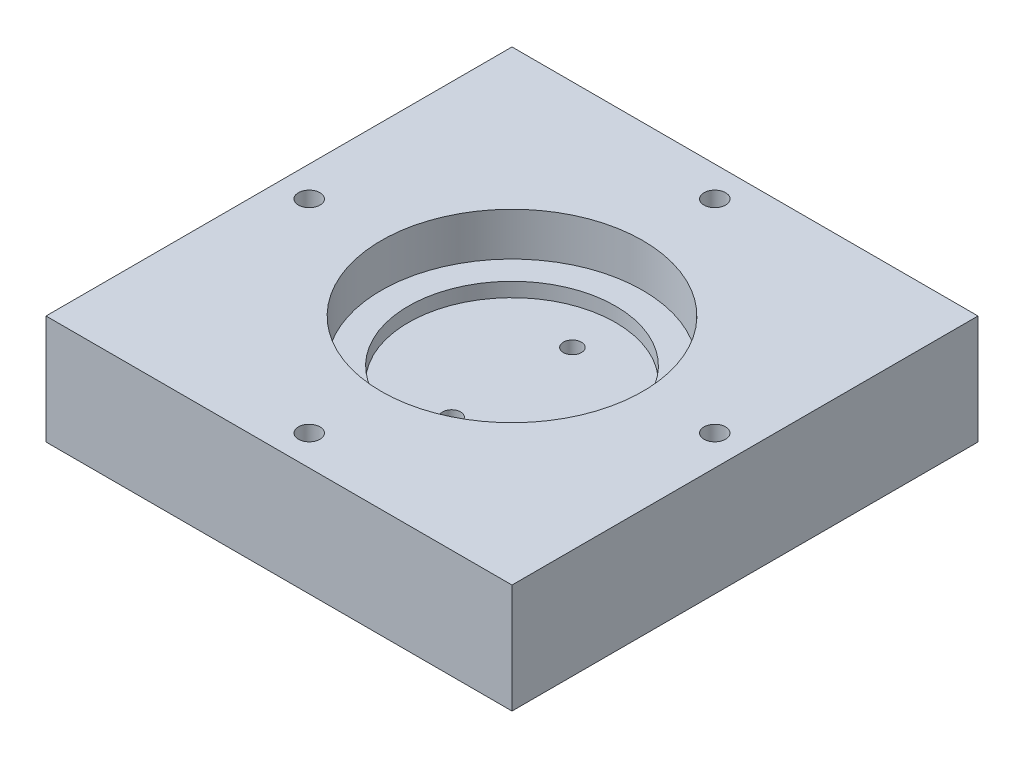
from build123d import *

# Parameters (mm, degrees)
SKETCH1_R                       = 27
SKETCH1_R_2                     = 1.05
BOSS_EXTRUDE1_DEPTH             = 3
SKETCH2_R                       = 27
SKETCH2_R_2                     = 12
BOSS_EXTRUDE2_DEPTH             = 1.65
SKETCH3_R                       = 27
SKETCH3_R_2                     = 15.15
BOSS_EXTRUDE3_DEPTH             = 5
BOSS_EXTRUDE4_START             = 3
SKETCH4_R                       = 27
SKETCH4_R_2                     = 1.875
BOSS_EXTRUDE4_DEPTH             = 3
SKETCH6_R                       = 1.25
CUT_EXTRUDE2_DEPTH              = 41.224650402
CIRPATTERN2_COUNT               = 4
BOSS_EXTRUDE5_REACH             = 41.384
BOSS_EXTRUDE5_DIRECTION_2_REACH = 41.384


with BuildPart() as part:
    # Sketch1 → Boss-Extrude1 (new body)
    with BuildSketch(Plane(origin=(0, 0, 0), x_dir=(1, 0, 0), z_dir=(0, 1, 0))):
        with Locations(Location((0, 0, 0), (0, 0, 270))):
            Circle(SKETCH1_R)
        with Locations(Location((0, 7, 0), (0, 0, 270))):
            Circle(SKETCH1_R_2, mode=Mode.SUBTRACT)
        with Locations(Location((0, -7, 0), (0, 0, 270))):
            Circle(SKETCH1_R_2, mode=Mode.SUBTRACT)
    extrude(amount=BOSS_EXTRUDE1_DEPTH)

    # Sketch2 → Boss-Extrude2 (add)
    with BuildSketch(Plane(origin=(0, 3, 0), x_dir=(1, 0, 0), z_dir=(0, 1, 0))):
        with Locations(Location((0, 0, 0), (0, 0, 270))):
            Circle(SKETCH2_R)
        with Locations(Location((0, 0, 0), (0, 0, 270))):
            Circle(SKETCH2_R_2, mode=Mode.SUBTRACT)
    extrude(amount=BOSS_EXTRUDE2_DEPTH)

    # Sketch3 → Boss-Extrude3 (add)
    with BuildSketch(Plane(origin=(0, 4.65, 0), x_dir=(1, 0, 0), z_dir=(0, 1, 0))):
        with Locations(Location((0, 0, 0), (0, 0, 270))):
            Circle(SKETCH3_R)
        with Locations(Location((0, 0, 0), (0, 0, 270))):
            Circle(SKETCH3_R_2, mode=Mode.SUBTRACT)
    extrude(amount=BOSS_EXTRUDE3_DEPTH)

    # Sketch4 → Boss-Extrude4 (add)
    with BuildSketch(Plane.XZ.offset(BOSS_EXTRUDE4_START)):
        with Locations(Location((0, 0, 0), (0, 0, 270))):
            Circle(SKETCH4_R)
        with Locations(Location((0, -7, 0), (0, 0, 270))):
            Circle(SKETCH4_R_2, mode=Mode.SUBTRACT)
        with Locations(Location((0, 7, 0), (0, 0, 270))):
            Circle(SKETCH4_R_2, mode=Mode.SUBTRACT)
    extrude(amount=-BOSS_EXTRUDE4_DEPTH)

    # Sketch6 → Cut-Extrude2 (cut, through all)
    with BuildSketch(Plane(origin=(0, 9.65, 0), x_dir=(1, 0, 0), z_dir=(0, 1, 0))):
        with Locations(Location((0, 23.5, 0), (0, 0, 270))):
            Circle(SKETCH6_R)
    cut_extrude2 = extrude(amount=-CUT_EXTRUDE2_DEPTH, mode=Mode.SUBTRACT)

    # CirPattern2: Cut-Extrude2 ×4 about axis
    cirpattern2_axis = Axis((0, 0, 0), (0, 1, 0))
    for i in range(1, CIRPATTERN2_COUNT):
        add(cut_extrude2.rotate(cirpattern2_axis, i * 360 / CIRPATTERN2_COUNT), mode=Mode.SUBTRACT)

    # Boss-Extrude5: up to this face of the body (flat: up to its plane)
    boss_extrude5_end = Plane(part.part.faces().sort_by_distance((0, 9.65, -26.236324676))[0])
    # Sketch7 → Boss-Extrude5 (add, up to the picked face)
    with BuildSketch(Plane(origin=(0, 0, 0), x_dir=(1, 0, 0), z_dir=(0, 1, 0)), mode=Mode.PRIVATE) as boss_extrude5_sk1:
        with BuildLine():
            Line((0, 27), (-27, 27))
            Line((-27, 27), (-27, 0))
            ThreePointArc((-27, 0), (-19.091883092, 19.091883092), (0, 27))
        make_face()
    boss_extrude5_tool1 = split(extrude(boss_extrude5_sk1.sketch, amount=BOSS_EXTRUDE5_REACH, mode=Mode.PRIVATE), bisect_by=boss_extrude5_end, keep=Keep.BOTH, mode=Mode.PRIVATE)
    # Sketch7 → Boss-Extrude5 (add, up to the picked face)
    with BuildSketch(Plane(origin=(0, 0, 0), x_dir=(1, 0, 0), z_dir=(0, 1, 0)), mode=Mode.PRIVATE) as boss_extrude5_sk2:
        with BuildLine():
            Line((27, 27), (0, 27))
            ThreePointArc((0, 27), (19.091883092, 19.091883092), (27, 0))
            Line((27, 0), (27, 27))
        make_face()
    boss_extrude5_tool2 = split(extrude(boss_extrude5_sk2.sketch, amount=BOSS_EXTRUDE5_REACH, mode=Mode.PRIVATE), bisect_by=boss_extrude5_end, keep=Keep.BOTH, mode=Mode.PRIVATE)
    # Sketch7 → Boss-Extrude5 (add, up to the picked face)
    with BuildSketch(Plane(origin=(0, 0, 0), x_dir=(1, 0, 0), z_dir=(0, 1, 0)), mode=Mode.PRIVATE) as boss_extrude5_sk3:
        with BuildLine():
            Line((27, -27), (27, 0))
            ThreePointArc((27, 0), (19.091883057, -19.091883127), (-9.8e-08, -27))
            Line((-9.8e-08, -27), (27, -27))
        make_face()
    boss_extrude5_tool3 = split(extrude(boss_extrude5_sk3.sketch, amount=BOSS_EXTRUDE5_REACH, mode=Mode.PRIVATE), bisect_by=boss_extrude5_end, keep=Keep.BOTH, mode=Mode.PRIVATE)
    # Sketch7 → Boss-Extrude5 (add, up to the picked face)
    with BuildSketch(Plane(origin=(0, 0, 0), x_dir=(1, 0, 0), z_dir=(0, 1, 0)), mode=Mode.PRIVATE) as boss_extrude5_sk4:
        with BuildLine():
            ThreePointArc((-9.8e-08, -27), (-19.091883127, -19.091883057), (-27, 0))
            Line((-27, 0), (-27, -27))
            Line((-27, -27), (-9.8e-08, -27))
        make_face()
    boss_extrude5_tool4 = split(extrude(boss_extrude5_sk4.sketch, amount=BOSS_EXTRUDE5_REACH, mode=Mode.PRIVATE), bisect_by=boss_extrude5_end, keep=Keep.BOTH, mode=Mode.PRIVATE)
    add(boss_extrude5_tool1.solids().sort_by(Axis((-20.969066, 0, -20.969066), (0, 1, 0)))[0])
    add(boss_extrude5_tool2.solids().sort_by(Axis((20.969066, 0, -20.969066), (0, 1, 0)))[0])
    add(boss_extrude5_tool3.solids().sort_by(Axis((20.969066, 0, 20.969066), (0, 1, 0)))[0])
    add(boss_extrude5_tool4.solids().sort_by(Axis((-20.969066, 0, 20.969066), (0, 1, 0)))[0])

    # Boss-Extrude5 direction 2: up to this face of the body (flat: up to its plane)
    boss_extrude5_direction_2_end = Plane(part.part.faces().sort_by_distance((0, -3, 0))[0])
    # Sketch7 → Boss-Extrude5 direction 2 (add, up to the picked face)
    with BuildSketch(Plane(origin=(0, 0, 0), x_dir=(1, 0, 0), z_dir=(0, 1, 0)), mode=Mode.PRIVATE) as boss_extrude5_direction_2_sk1:
        with BuildLine():
            Line((0, 27), (-27, 27))
            Line((-27, 27), (-27, 0))
            ThreePointArc((-27, 0), (-19.091883092, 19.091883092), (0, 27))
        make_face()
    boss_extrude5_direction_2_tool1 = split(extrude(boss_extrude5_direction_2_sk1.sketch, amount=-BOSS_EXTRUDE5_DIRECTION_2_REACH, mode=Mode.PRIVATE), bisect_by=boss_extrude5_direction_2_end, keep=Keep.BOTH, mode=Mode.PRIVATE)
    # Sketch7 → Boss-Extrude5 direction 2 (add, up to the picked face)
    with BuildSketch(Plane(origin=(0, 0, 0), x_dir=(1, 0, 0), z_dir=(0, 1, 0)), mode=Mode.PRIVATE) as boss_extrude5_direction_2_sk2:
        with BuildLine():
            Line((27, 27), (0, 27))
            ThreePointArc((0, 27), (19.091883092, 19.091883092), (27, 0))
            Line((27, 0), (27, 27))
        make_face()
    boss_extrude5_direction_2_tool2 = split(extrude(boss_extrude5_direction_2_sk2.sketch, amount=-BOSS_EXTRUDE5_DIRECTION_2_REACH, mode=Mode.PRIVATE), bisect_by=boss_extrude5_direction_2_end, keep=Keep.BOTH, mode=Mode.PRIVATE)
    # Sketch7 → Boss-Extrude5 direction 2 (add, up to the picked face)
    with BuildSketch(Plane(origin=(0, 0, 0), x_dir=(1, 0, 0), z_dir=(0, 1, 0)), mode=Mode.PRIVATE) as boss_extrude5_direction_2_sk3:
        with BuildLine():
            Line((27, -27), (27, 0))
            ThreePointArc((27, 0), (19.091883057, -19.091883127), (-9.8e-08, -27))
            Line((-9.8e-08, -27), (27, -27))
        make_face()
    boss_extrude5_direction_2_tool3 = split(extrude(boss_extrude5_direction_2_sk3.sketch, amount=-BOSS_EXTRUDE5_DIRECTION_2_REACH, mode=Mode.PRIVATE), bisect_by=boss_extrude5_direction_2_end, keep=Keep.BOTH, mode=Mode.PRIVATE)
    # Sketch7 → Boss-Extrude5 direction 2 (add, up to the picked face)
    with BuildSketch(Plane(origin=(0, 0, 0), x_dir=(1, 0, 0), z_dir=(0, 1, 0)), mode=Mode.PRIVATE) as boss_extrude5_direction_2_sk4:
        with BuildLine():
            ThreePointArc((-9.8e-08, -27), (-19.091883127, -19.091883057), (-27, 0))
            Line((-27, 0), (-27, -27))
            Line((-27, -27), (-9.8e-08, -27))
        make_face()
    boss_extrude5_direction_2_tool4 = split(extrude(boss_extrude5_direction_2_sk4.sketch, amount=-BOSS_EXTRUDE5_DIRECTION_2_REACH, mode=Mode.PRIVATE), bisect_by=boss_extrude5_direction_2_end, keep=Keep.BOTH, mode=Mode.PRIVATE)
    add(boss_extrude5_direction_2_tool1.solids().sort_by(Axis((-20.969066, 0, -20.969066), (0, -1, 0)))[0])
    add(boss_extrude5_direction_2_tool2.solids().sort_by(Axis((20.969066, 0, -20.969066), (0, -1, 0)))[0])
    add(boss_extrude5_direction_2_tool3.solids().sort_by(Axis((20.969066, 0, 20.969066), (0, -1, 0)))[0])
    add(boss_extrude5_direction_2_tool4.solids().sort_by(Axis((-20.969066, 0, 20.969066), (0, -1, 0)))[0])


solid = part.part
